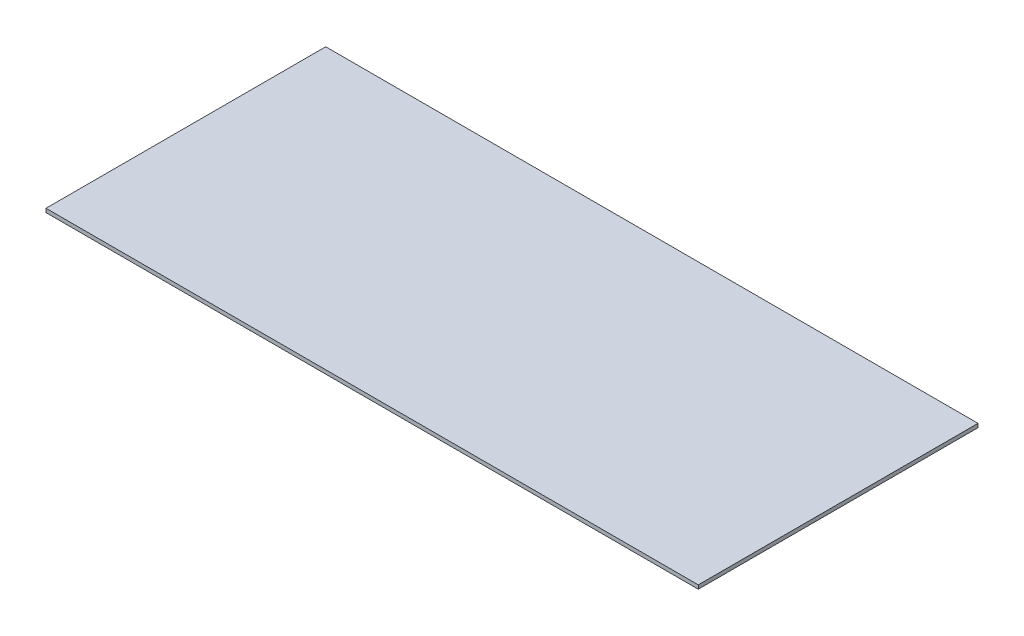
from build123d import *

# Parameters (mm, degrees)
SKETCH1_W           = 384.3
SKETCH1_H           = 164.8
BOSS_EXTRUDE1_DEPTH = 2.243762604


with BuildPart() as part:
    # Sketch1 → Boss-Extrude1 (new body)
    with BuildSketch(Plane(origin=(0, 0, 0), x_dir=(1, 0, 0), z_dir=(0, 1, 0))):
        Rectangle(SKETCH1_W, SKETCH1_H)
    extrude(amount=BOSS_EXTRUDE1_DEPTH)


solid = part.part
